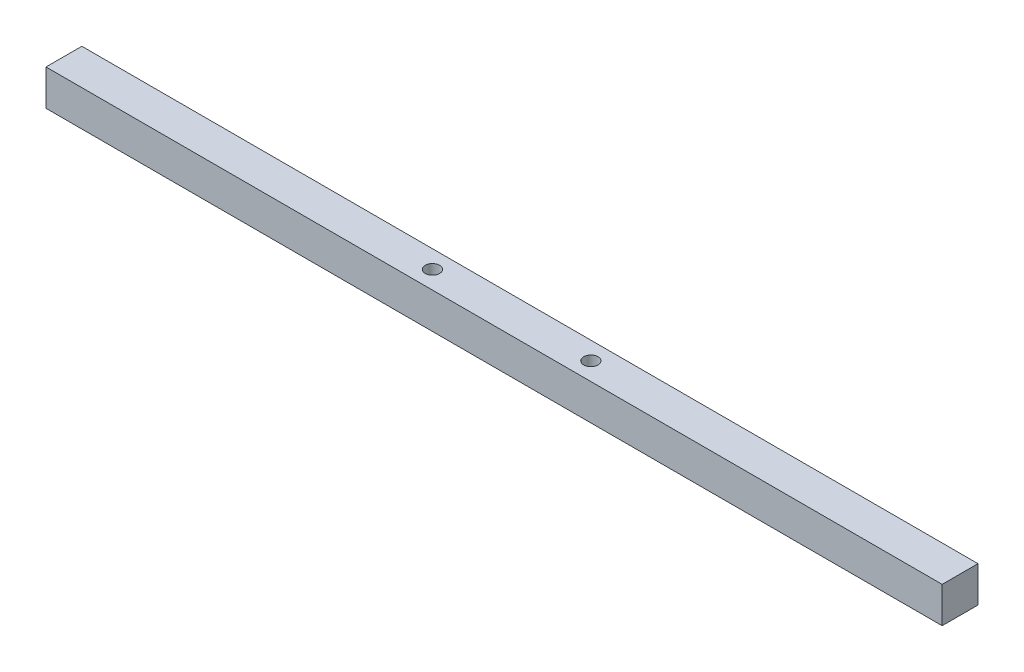
from build123d import *

# Parameters (mm, degrees)
SKETCH1_W           = 20
SKETCH1_H           = 20
BOSS_EXTRUDE1_DEPTH = 500
SKETCH2_R           = 4
CUT_EXTRUDE1_DEPTH  = 501.49975025


with BuildPart() as part:
    # Sketch1 → Boss-Extrude1 (new body)
    with BuildSketch(Plane(origin=(0, 0, 0), x_dir=(0, 0, -1), z_dir=(1, 0, 0))):
        Rectangle(SKETCH1_W, SKETCH1_H)
    extrude(amount=BOSS_EXTRUDE1_DEPTH)

    # Sketch2 → Cut-Extrude1 (cut, through all)
    with BuildSketch(Plane(origin=(0, 10, 0), x_dir=(1, 0, 0), z_dir=(0, 1, 0))):
        with Locations(Location((205.61, 0, 0), (0, 0, 270))):
            Circle(SKETCH2_R)
        with Locations(Location((294, 0, 0), (0, 0, 270))):
            Circle(SKETCH2_R)
    extrude(amount=-CUT_EXTRUDE1_DEPTH, mode=Mode.SUBTRACT)


solid = part.part
